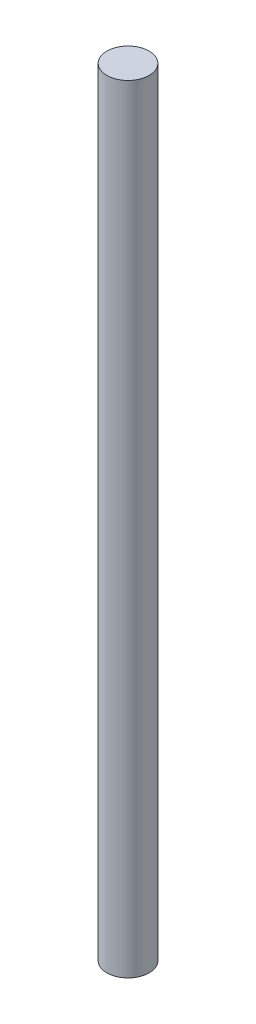
from build123d import *

# Parameters (mm, degrees)
SKETCH1_R           = 12.5
BOSS_EXTRUDE1_DEPTH = 460


with BuildPart() as part:
    # Sketch1 → Boss-Extrude1 (new body)
    with BuildSketch(Plane(origin=(0, 0, 0), x_dir=(1, 0, 0), z_dir=(0, 1, 0))):
        with Locations(Location((0, 0, 0), (0, 0, 90))):
            Circle(SKETCH1_R)
    extrude(amount=BOSS_EXTRUDE1_DEPTH)


solid = part.part
